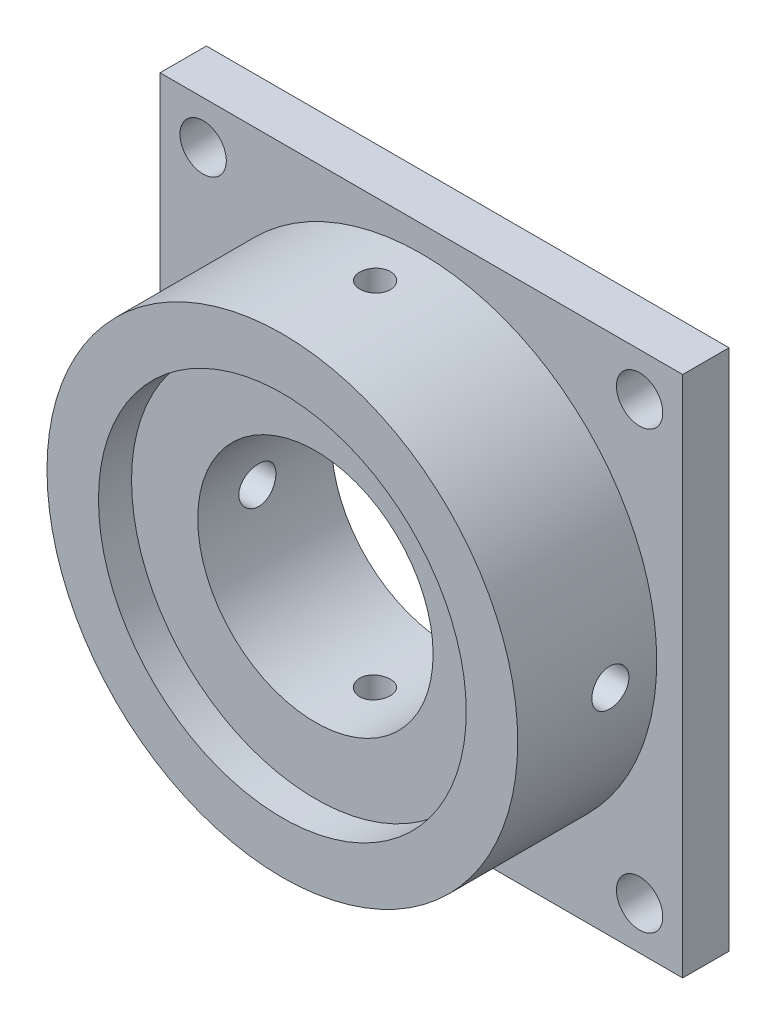
from build123d import *

# Parameters (mm, degrees)
SKETCH1_R           = 25.4
SKETCH1_R_2         = 12.7
BOSS_EXTRUDE1_DEPTH = 20
SKETCH2_R           = 2
CUT_EXTRUDE1_DEPTH  = 30
CUT_EXTRUDE2_START  = -3.5687
SKETCH3_R           = 19.84375
SKETCH3_R_2         = 12.7
CUT_EXTRUDE2_DEPTH  = 3.5687
SKETCH5_R           = 1.65
CUT_EXTRUDE4_DEPTH  = 31.7
SKETCH6_W           = 56.4
SKETCH6_H           = 56.4
SKETCH6_R           = 12.7
SKETCH6_R_2         = 2.5
BOSS_EXTRUDE2_DEPTH = 5
SKETCH7_R           = 19.5
CUT_EXTRUDE5_DEPTH  = 2


with BuildPart() as part:
    # Sketch1 → Boss-Extrude1 (new body)
    with BuildSketch(Plane.XY):
        Circle(SKETCH1_R)
        Circle(SKETCH1_R_2, mode=Mode.SUBTRACT)
    extrude(amount=BOSS_EXTRUDE1_DEPTH)

    # Sketch2 → Cut-Extrude1 (cut, symmetric)
    with BuildSketch(Plane(origin=(0, 0, 0), x_dir=(0, 0, -1), z_dir=(1, 0, 0))):
        with Locations((-10, 0)):
            Circle(SKETCH2_R)
    extrude(amount=CUT_EXTRUDE1_DEPTH, both=True, mode=Mode.SUBTRACT)

    # Sketch3 → Cut-Extrude2 (cut)
    with BuildSketch(Plane.XY.offset(20).offset(CUT_EXTRUDE2_START)):
        Circle(SKETCH3_R)
        Circle(SKETCH3_R_2, mode=Mode.SUBTRACT)
    extrude(amount=CUT_EXTRUDE2_DEPTH, mode=Mode.SUBTRACT)

    # Sketch5 → Cut-Extrude4 (cut, symmetric)
    with BuildSketch(Plane(origin=(0, 0, 0), x_dir=(1, 0, 0), z_dir=(0, 1, 0))):
        with Locations(Location((0, -10, 0), (0, 0, 270))):
            Circle(SKETCH5_R)
    extrude(amount=CUT_EXTRUDE4_DEPTH, both=True, mode=Mode.SUBTRACT)

    # Sketch6 → Boss-Extrude2 (add)
    with BuildSketch(Plane(origin=(0, 0, 0), x_dir=(-1, 0, 0), z_dir=(0, 0, -1))):
        Rectangle(SKETCH6_W, SKETCH6_H)
        with Locations(Location((0, 0, 0), (0, 0, 180))):
            Circle(SKETCH6_R, mode=Mode.SUBTRACT)
        with Locations((-23.55, 23.55)):
            Circle(SKETCH6_R_2, mode=Mode.SUBTRACT)
        with Locations((23.55, 23.55)):
            Circle(SKETCH6_R_2, mode=Mode.SUBTRACT)
        with Locations((23.55, -23.55)):
            Circle(SKETCH6_R_2, mode=Mode.SUBTRACT)
        with Locations((-23.55, -23.55)):
            Circle(SKETCH6_R_2, mode=Mode.SUBTRACT)
    extrude(amount=-BOSS_EXTRUDE2_DEPTH)

    # Sketch7 → Cut-Extrude5 (cut)
    with BuildSketch(Plane(origin=(0, 0, 0), x_dir=(-1, 0, 0), z_dir=(0, 0, -1))):
        Circle(SKETCH7_R)
    extrude(amount=-CUT_EXTRUDE5_DEPTH, mode=Mode.SUBTRACT)


solid = part.part
